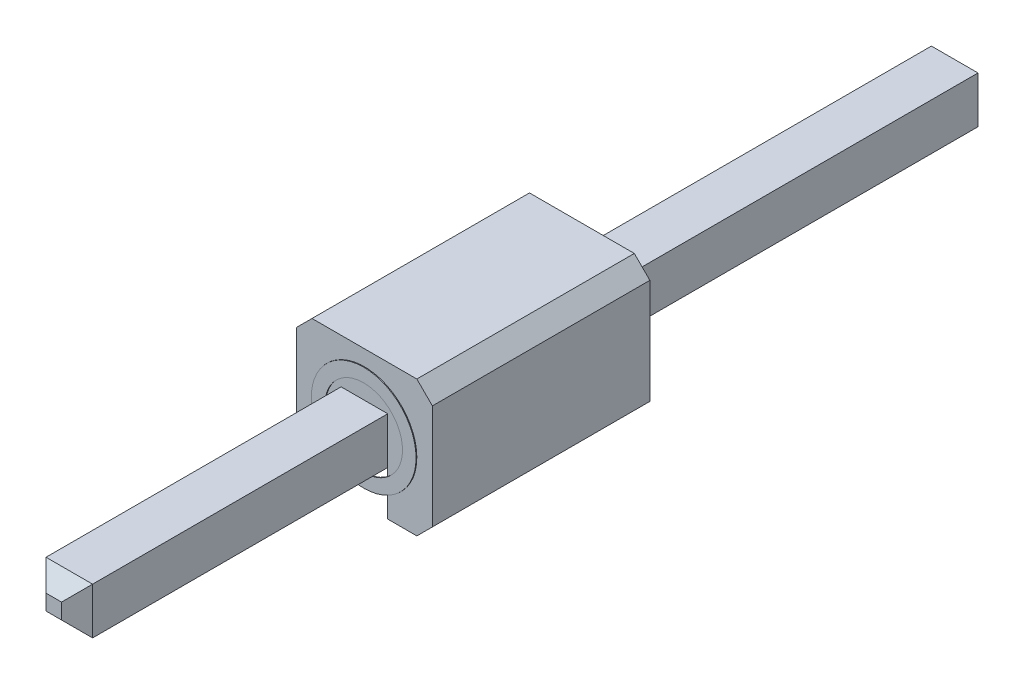
from build123d import *

# Parameters (mm, degrees)
ESQUISSE1_W             = 0.6
ESQUISSE1_H             = 0.6
BOSS_EXTRU_1_DEPTH      = 2.8
ESQUISSE2_W             = 0.6
ESQUISSE2_H             = 0.575
ENL_V_MAT_EXTRU_1_DEPTH = 1
BOSS_EXTRU_2_DEPTH      = 4
BOSS_EXTRU_2_DEPTH_BACK = 7.8
ESQUISSE3_W             = 0.6
ESQUISSE3_H             = 0.6
CHANFREIN1_SIZE         = 0.2
ESQUISSE4_R             = 0.674645205
ESQUISSE4_R_2           = 0.5
BOSS_EXTRU_3_DEPTH      = 0.01


with BuildPart() as part:
    # Esquisse1 → Boss.-Extru.1 (new body)
    with BuildSketch(Plane.XY):
        Polygon((-0.675, 0.875), (-0.875, 0.675), (-0.875, -0.675), (-0.675, -0.875), (0.675, -0.875), (0.875, -0.675), (0.875, 0.675), (0.675, 0.875), align=None)
        Rectangle(ESQUISSE1_W, ESQUISSE1_H, mode=Mode.SUBTRACT)
    extrude(amount=BOSS_EXTRU_1_DEPTH)

    # Esquisse2 → Enlèv. mat.-Extru.1 (cut)
    with BuildSketch(Plane.XY.offset(2.8)):
        with Locations((0, -0.5875)):
            Rectangle(ESQUISSE2_W, ESQUISSE2_H)
    extrude(amount=-ENL_V_MAT_EXTRU_1_DEPTH, mode=Mode.SUBTRACT)

    # Esquisse3 → Boss.-Extru.2 (add, two sides: drawn at the far end of the back side and taken through both)
    with BuildSketch(Plane.XY.offset(2.8).offset(-BOSS_EXTRU_2_DEPTH_BACK)):
        Rectangle(ESQUISSE3_W, ESQUISSE3_H)
    extrude(amount=BOSS_EXTRU_2_DEPTH + BOSS_EXTRU_2_DEPTH_BACK)

    # Chanfrein1
    chanfrein1_edges = [part.edges().sort_by_distance(p)[0] for p in [
        (0, -0.3, -5),
        (0.3, 0, -5),
        (-0.3, 0, -5),
        (0, 0.3, -5),
        (0.3, 0, 6.8),
        (0, 0.3, 6.8),
        (-0.3, 0, 6.8),
        (0, -0.3, 6.8),
    ]]
    chamfer(chanfrein1_edges, length=CHANFREIN1_SIZE)

    # Esquisse4 → Boss.-Extru.3 (add)
    with BuildSketch(Plane.XY.offset(2.8)):
        with Locations(Location((0, 0, 0), (0, 0, 243.597249523))):
            Circle(ESQUISSE4_R)
        with Locations(Location((0, 0, 0), (0, 0, 233.130102354))):
            Circle(ESQUISSE4_R_2, mode=Mode.SUBTRACT)
    extrude(amount=BOSS_EXTRU_3_DEPTH)


solid = part.part
